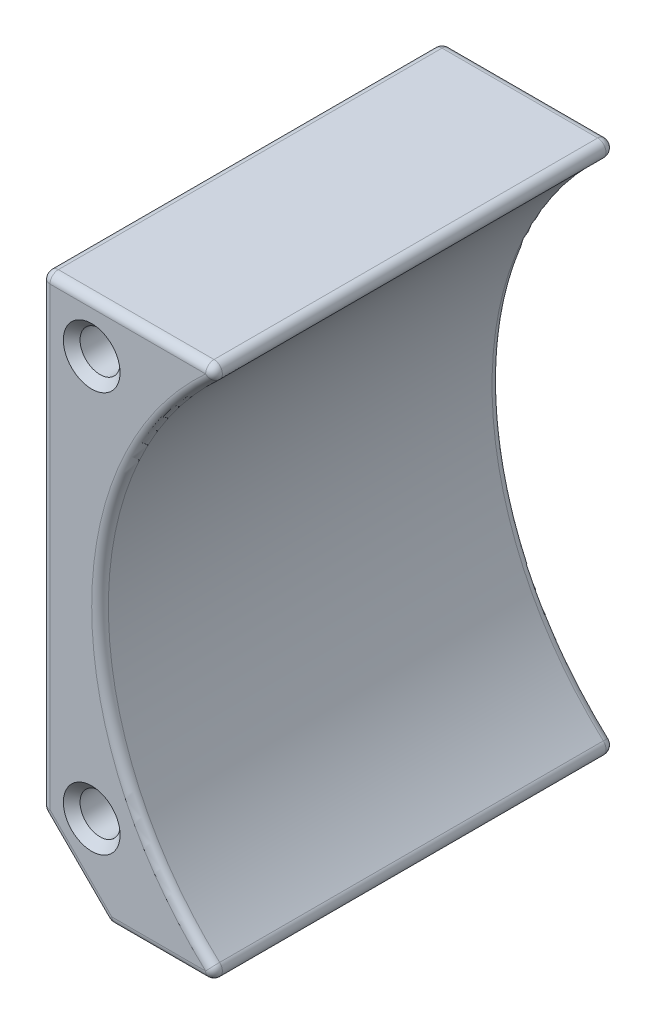
from build123d import *

# Parameters (mm, degrees)
BOSS_EXTRUDE1_DEPTH = 38.1
SKETCH2_R           = 1.905
CUT_EXTRUDE1_DEPTH  = 66.935388863
CHAMFER1_SIZE       = 6.35
FILLET1_R           = 0.79375
CHAMFER2_SIZE       = 0.79375


with BuildPart() as part:
    # Sketch1 → Boss-Extrude1 (new body)
    with BuildSketch(Plane.XY):
        with BuildLine():
            Line((0, 0), (17.754591081, 0))
            ThreePointArc((17.754591081, 0), (5.55625, 25.4), (17.754591081, 50.8))
            Line((17.754591081, 50.8), (0, 50.8))
            Line((0, 50.8), (0, 0))
        make_face()
    extrude(amount=BOSS_EXTRUDE1_DEPTH)

    # Sketch2 → Cut-Extrude1 (cut, through all)
    with BuildSketch(Plane.XY.offset(38.1)):
        with Locations((4.7625, 46.0375)):
            Circle(SKETCH2_R)
        with Locations((4.7625, 7.9375)):
            Circle(SKETCH2_R)
    extrude(amount=-CUT_EXTRUDE1_DEPTH, mode=Mode.SUBTRACT)

    # Chamfer1
    chamfer1_edges = [part.edges().sort_by_distance(p)[0] for p in [
        (0, 0, 19.05),
    ]]
    chamfer(chamfer1_edges, length=CHAMFER1_SIZE)

    # Fillet1
    fillet1_edges = [part.edges().sort_by_distance(p)[0] for p in [
        (5.55625, 25.4, 38.1),
        (8.877295541, 50.8, 38.1),
        (12.052295541, 0, 0),
        (12.052295541, 0, 38.1),
        (6.35, 0, 19.05),
        (3.175, 3.175, 0),
        (0, 6.35, 19.05),
        (3.175, 3.175, 38.1),
        (0, 28.575, 38.1),
        (8.877295541, 50.8, 0),
        (5.55625, 25.4, 0),
        (0, 28.575, 0),
        (0, 50.8, 19.05),
        (17.754591081, 50.8, 19.05),
        (17.754591081, 0, 19.05),
    ]]
    fillet(fillet1_edges, radius=FILLET1_R)

    # Chamfer2
    chamfer2_edges = [part.edges().sort_by_distance(p)[0] for p in [
        (2.8575, 46.0375, 0),
        (2.8575, 46.0375, 38.1),
        (2.8575, 7.9375, 0),
        (2.8575, 7.9375, 38.1),
    ]]
    chamfer(chamfer2_edges, length=CHAMFER2_SIZE)


solid = part.part
